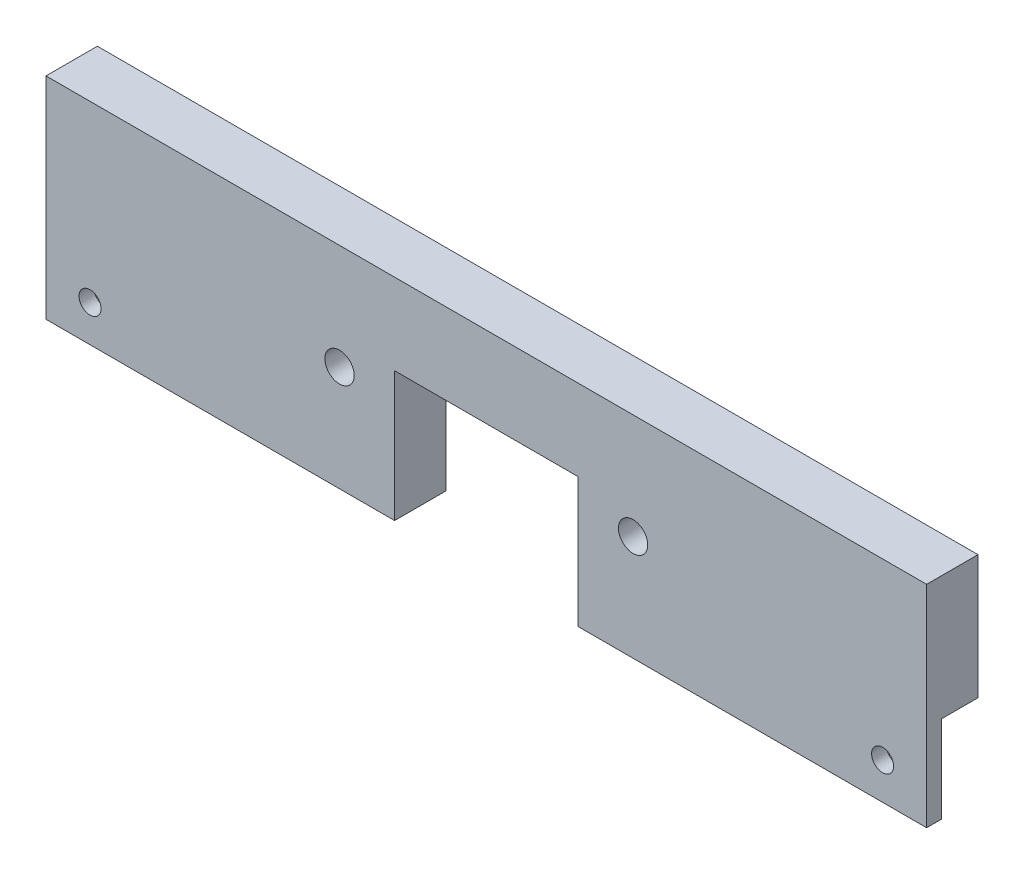
from build123d import *

# Parameters (mm, degrees)
SKETCH2_W           = 120
SKETCH2_H           = 28.73
SKETCH2_R           = 1.5
SKETCH2_R_2         = 2
BOSS_EXTRUDE1_DEPTH = 7
SKETCH3_W           = 12
SKETCH3_H           = 13.95
CUT_EXTRUDE1_DEPTH  = 5
SKETCH4_W           = 25
SKETCH4_H           = 46.747057702
CUT_EXTRUDE2_DEPTH  = 7
SKETCH5_R           = 4
CUT_EXTRUDE3_DEPTH  = 2


with BuildPart() as part:
    # Sketch2 → Boss-Extrude1 (new body)
    with BuildSketch(Plane.XY):
        with Locations((0, 25.635)):
            Rectangle(SKETCH2_W, SKETCH2_H)
        with Locations((-54, 16.27)):
            Circle(SKETCH2_R, mode=Mode.SUBTRACT)
        with Locations((54, 16.27)):
            Circle(SKETCH2_R, mode=Mode.SUBTRACT)
        with Locations((-20, 25.635)):
            Circle(SKETCH2_R_2, mode=Mode.SUBTRACT)
        with Locations(Location((20, 25.635, 0), (0, 0, 180))):
            Circle(SKETCH2_R_2, mode=Mode.SUBTRACT)
    extrude(amount=BOSS_EXTRUDE1_DEPTH)

    # Sketch3 → Cut-Extrude1 (cut)
    with BuildSketch(Plane(origin=(0, 0, 0), x_dir=(-1, 0, 0), z_dir=(0, 0, -1))):
        with Locations((-54, 16.135)):
            Rectangle(SKETCH3_W, SKETCH3_H)
        with Locations((54, 16.135)):
            Rectangle(SKETCH3_W, SKETCH3_H)
    extrude(amount=-CUT_EXTRUDE1_DEPTH, mode=Mode.SUBTRACT)

    # Sketch4 → Cut-Extrude2 (cut)
    with BuildSketch(Plane.XY.offset(7)):
        with Locations((0, 5.58721862)):
            Rectangle(SKETCH4_W, SKETCH4_H)
    extrude(amount=-CUT_EXTRUDE2_DEPTH, mode=Mode.SUBTRACT)

    # Sketch5 → Cut-Extrude3 (cut)
    with BuildSketch(Plane.XY):
        with Locations((20, 25.635)):
            Circle(SKETCH5_R)
        with Locations((-20, 25.635)):
            Circle(SKETCH5_R)
    extrude(amount=CUT_EXTRUDE3_DEPTH, mode=Mode.SUBTRACT)


solid = part.part
